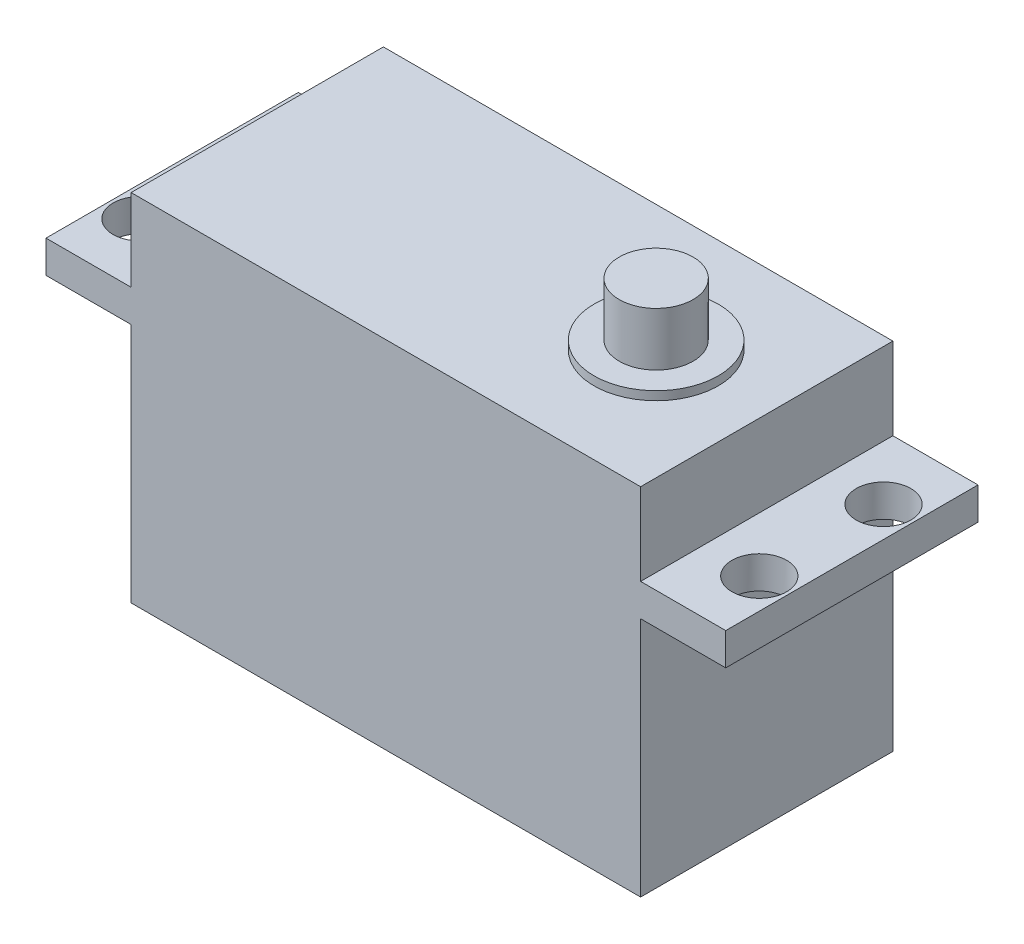
from build123d import *

# Parameters (mm, degrees)
SKETCH1_W           = 41
SKETCH1_H           = 19.4
BOSS_EXTRUDE1_DEPTH = 20.3
SKETCH2_W           = 54.7
SKETCH2_H           = 20.3
BOSS_EXTRUDE2_DEPTH = 2.6
SKETCH3_W           = 41
SKETCH3_H           = 20.3
BOSS_EXTRUDE3_DEPTH = 6.6
SKETCH4_R           = 2.2
CUT_EXTRUDE1_DEPTH  = 57.442116367
SKETCH5_R           = 5
BOSS_EXTRUDE4_DEPTH = 0.7
SKETCH6_R           = 2.97
BOSS_EXTRUDE5_DEPTH = 4.3


with BuildPart() as part:
    # Sketch1 → Boss-Extrude1 (new body)
    with BuildSketch(Plane.XY):
        with Locations((20.5, -9.7)):
            Rectangle(SKETCH1_W, SKETCH1_H)
    extrude(amount=BOSS_EXTRUDE1_DEPTH)

    # Sketch2 → Boss-Extrude2 (add)
    with BuildSketch(Plane(origin=(0, 0, 0), x_dir=(1, 0, 0), z_dir=(0, 1, 0))):
        with Locations((20.5, -10.15)):
            Rectangle(SKETCH2_W, SKETCH2_H)
    extrude(amount=BOSS_EXTRUDE2_DEPTH)

    # Sketch3 → Boss-Extrude3 (add)
    with BuildSketch(Plane(origin=(0, 2.6, 0), x_dir=(1, 0, 0), z_dir=(0, 1, 0))):
        with Locations((20.5, -10.15)):
            Rectangle(SKETCH3_W, SKETCH3_H)
    extrude(amount=BOSS_EXTRUDE3_DEPTH)

    # Sketch4 → Cut-Extrude1 (cut, through all)
    with BuildSketch(Plane(origin=(0, 2.6, 0), x_dir=(1, 0, 0), z_dir=(0, 1, 0))):
        with Locations(Location((-4.4, -15.15, 0), (0, 0, 270))):
            Circle(SKETCH4_R)
        with Locations(Location((-4.4, -5.15, 0), (0, 0, 270))):
            Circle(SKETCH4_R)
        with Locations(Location((45.4, -15.15, 0), (0, 0, 270))):
            Circle(SKETCH4_R)
        with Locations(Location((45.4, -5.15, 0), (0, 0, 270))):
            Circle(SKETCH4_R)
    extrude(amount=-CUT_EXTRUDE1_DEPTH, mode=Mode.SUBTRACT)

    # Sketch5 → Boss-Extrude4 (add)
    with BuildSketch(Plane(origin=(0, 9.2, 0), x_dir=(1, 0, 0), z_dir=(0, 1, 0))):
        with Locations(Location((32.1, -10.15, 0), (0, 0, 90))):
            Circle(SKETCH5_R)
    extrude(amount=BOSS_EXTRUDE4_DEPTH)

    # Sketch6 → Boss-Extrude5 (add)
    with BuildSketch(Plane(origin=(0, 9.9, 0), x_dir=(1, 0, 0), z_dir=(0, 1, 0))):
        with Locations(Location((32.1, -10.15, 0), (0, 0, 90))):
            Circle(SKETCH6_R)
    extrude(amount=BOSS_EXTRUDE5_DEPTH)


solid = part.part
